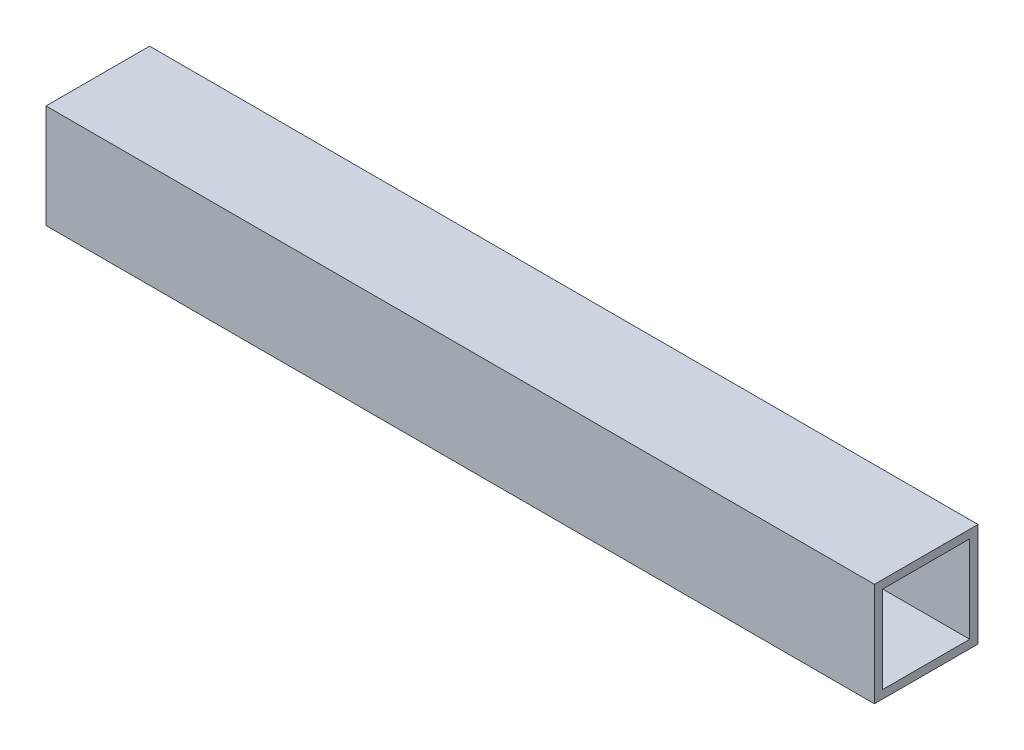
from build123d import *

# Parameters (mm, degrees)
SKETCH1_W           = 38.1
SKETCH1_H           = 38.1
SKETCH1_W_2         = 32.004
SKETCH1_H_2         = 32.004
BOSS_EXTRUDE1_DEPTH = 304.8


with BuildPart() as part:
    # Sketch1 → Boss-Extrude1 (new body)
    with BuildSketch(Plane.YZ):
        with Locations((-141.200909091, -9.582727273)):
            Rectangle(SKETCH1_W, SKETCH1_H)
        with Locations((-141.200909091, -9.582727273)):
            Rectangle(SKETCH1_W_2, SKETCH1_H_2, mode=Mode.SUBTRACT)
    extrude(amount=BOSS_EXTRUDE1_DEPTH)


solid = part.part
